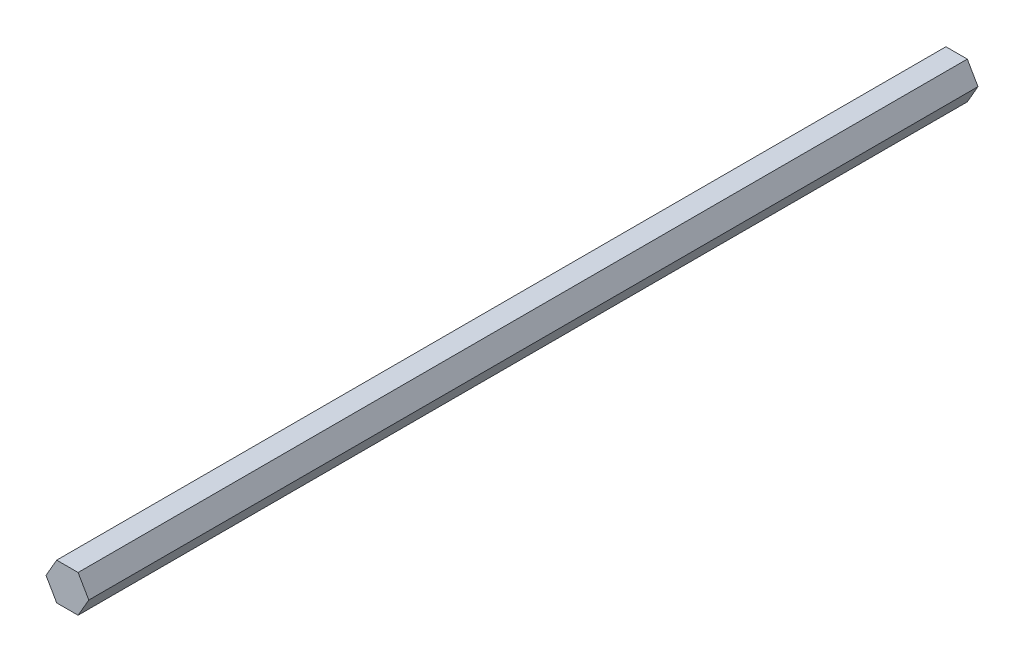
from build123d import *

# Parameters (mm, degrees)
BOSS_EXTRUDE1_DEPTH = 152.4


with BuildPart() as part:
    # Sketch1 → Boss-Extrude1 (new, symmetric)
    with BuildSketch(Plane.XY):
        Polygon((7.332348419, 0), (3.666174209, 6.35), (-3.666174209, 6.35), (-7.332348419, 0), (-3.666174209, -6.35), (3.666174209, -6.35), align=None)
    extrude(amount=BOSS_EXTRUDE1_DEPTH, both=True)


solid = part.part
